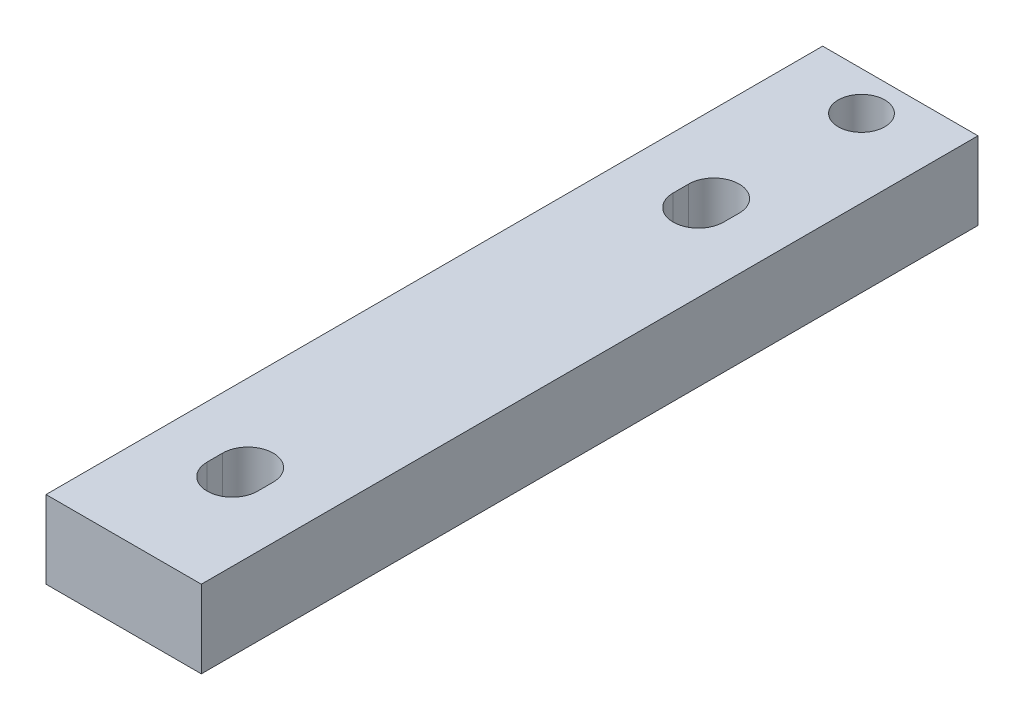
from build123d import *

# Parameters (mm, degrees)
SKETCH1_W           = 20
SKETCH1_H           = 100
SKETCH1_R           = 3
BOSS_EXTRUDE1_DEPTH = 10


with BuildPart() as part:
    # Sketch1 → Boss-Extrude1 (new body)
    with BuildSketch(Plane(origin=(0, 0, 0), x_dir=(1, 0, 0), z_dir=(0, 1, 0))):
        Rectangle(SKETCH1_W, SKETCH1_H)
        with Locations(Location((0, 45, 0), (0, 0, 270))):
            Circle(SKETCH1_R, mode=Mode.SUBTRACT)
        with BuildLine():
            Line((-3.25, 24), (-3.25, 26))
            ThreePointArc((-3.25, 26), (0, 29.25), (3.25, 26))
            Line((3.25, 26), (3.25, 24))
            ThreePointArc((3.25, 24), (0, 20.75), (-3.25, 24))
        make_face(mode=Mode.SUBTRACT)
        with BuildLine():
            Line((-3.25, -36), (-3.25, -34))
            ThreePointArc((-3.25, -34), (0, -30.75), (3.25, -34))
            Line((3.25, -34), (3.25, -36))
            ThreePointArc((3.25, -36), (0, -39.25), (-3.25, -36))
        make_face(mode=Mode.SUBTRACT)
    extrude(amount=BOSS_EXTRUDE1_DEPTH)


solid = part.part
